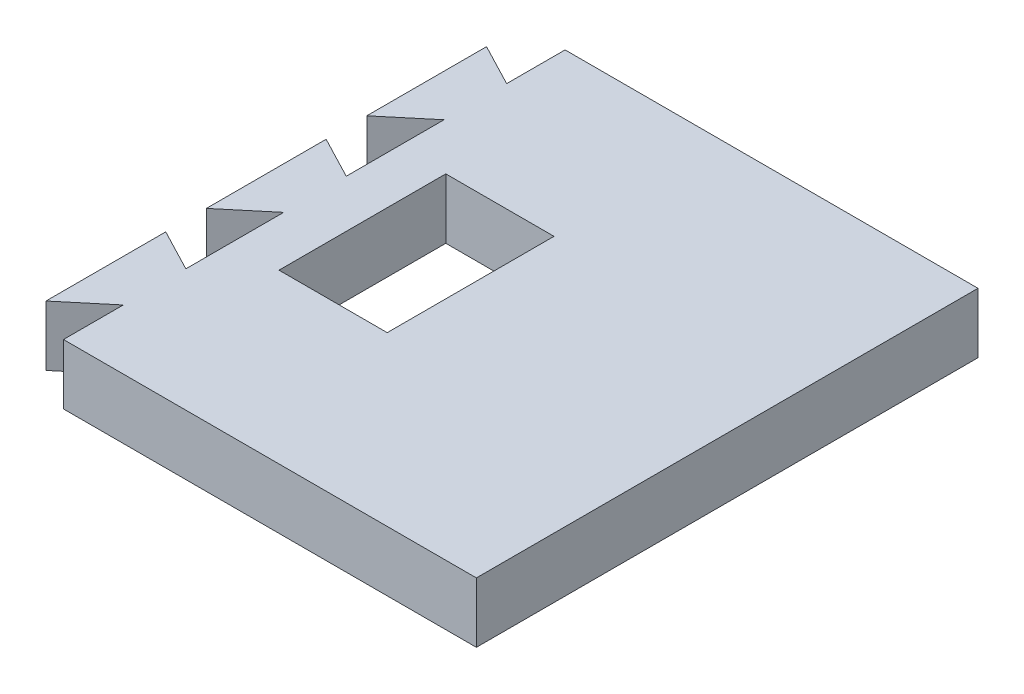
from build123d import *

# Parameters (mm, degrees)
SKETCH1_W           = 280
SKETCH1_H           = 210
BOSS_EXTRUDE1_DEPTH = 15
SKETCH2_R           = 5
BOSS_EXTRUDE2_DEPTH = 50
SKETCH3_W           = 10
SKETCH3_H           = 30
BOSS_EXTRUDE3_DEPTH = 50
SKETCH4_R           = 13
CUT_EXTRUDE1_DEPTH  = 20
SKETCH5_W           = 360.4909063
SKETCH5_H           = 249.182613404
SKETCH5_W_2         = 248.173776912
SKETCH5_H_2         = 125.095724948
CUT_EXTRUDE5_DEPTH  = 15
CUT_EXTRUDE6_START  = -65
SKETCH7_R           = 5
CUT_EXTRUDE6_DEPTH  = 65
SKETCH9_W           = 29.33
SKETCH9_H           = 16.92
CUT_EXTRUDE9_DEPTH  = 148.681383345
SKETCH8_R           = 10.1
CUT_EXTRUDE11_DEPTH = 10
SKETCH11_W          = 17.231524428
SKETCH11_H          = 37.334969593
CUT_EXTRUDE13_DEPTH = 50
SKETCH15_W          = 10
SKETCH15_H          = 50
CUT_EXTRUDE14_DEPTH = 5
SKETCH13_W          = 26.98462743
SKETCH13_H          = 41.59552633
CUT_EXTRUDE17_DEPTH = 140.766916639
CUT_EXTRUDE18_DEPTH = 140.766916639


with BuildPart() as part:
    # Sketch1 → Boss-Extrude1 (new body)
    with BuildSketch(Plane(origin=(0, 0, 0), x_dir=(1, 0, 0), z_dir=(0, 1, 0))):
        Rectangle(SKETCH1_W, SKETCH1_H)
    extrude(amount=BOSS_EXTRUDE1_DEPTH)

    # Sketch2 → Boss-Extrude2 (add)
    with BuildSketch(Plane(origin=(0, 15, 0), x_dir=(1, 0, 0), z_dir=(0, 1, 0))):
        with Locations(Location((-100, 0, 0), (0, 0, 270))):
            Circle(SKETCH2_R)
        with Locations(Location((-100, 45, 0), (0, 0, 270))):
            Circle(SKETCH2_R)
        with Locations(Location((-100, -45, 0), (0, 0, 270))):
            Circle(SKETCH2_R)
    extrude(amount=BOSS_EXTRUDE2_DEPTH)

    # Sketch3 → Boss-Extrude3 (add)
    with BuildSketch(Plane(origin=(0, 15, 0), x_dir=(1, 0, 0), z_dir=(0, 1, 0))):
        Rectangle(SKETCH3_W, SKETCH3_H)
    extrude(amount=BOSS_EXTRUDE3_DEPTH)

    # Sketch4 → Cut-Extrude1 (cut)
    with BuildSketch(Plane(origin=(5, 0, 0), x_dir=(0, 0, -1), z_dir=(1, 0, 0))):
        with Locations((0, 41.236240869)):
            Circle(SKETCH4_R)
    extrude(amount=-CUT_EXTRUDE1_DEPTH, mode=Mode.SUBTRACT)

    # Sketch5 → Cut-Extrude5 (cut)
    with BuildSketch(Plane(origin=(0, 0, 0), x_dir=(1, 0, 0), z_dir=(0, 1, 0))):
        with Locations((1.345115322, -3.19464889)):
            Rectangle(SKETCH5_W, SKETCH5_H)
        Rectangle(SKETCH5_W_2, SKETCH5_H_2, mode=Mode.SUBTRACT)
    extrude(amount=CUT_EXTRUDE5_DEPTH, mode=Mode.SUBTRACT)

    # Sketch7 → Cut-Extrude6 (cut)
    with BuildSketch(Plane(origin=(0, 65, 0), x_dir=(1, 0, 0), z_dir=(0, 1, 0)).offset(CUT_EXTRUDE6_START)):
        with Locations(Location((-100, 45, 0), (0, 0, 270))):
            Circle(SKETCH7_R)
        with Locations(Location((-100, 0, 0), (0, 0, 270))):
            Circle(SKETCH7_R)
        with Locations(Location((-100, -45, 0), (0, 0, 270))):
            Circle(SKETCH7_R)
    extrude(amount=CUT_EXTRUDE6_DEPTH, mode=Mode.SUBTRACT)

    # Sketch9 → Cut-Extrude9 (cut, through all)
    with BuildSketch(Plane(origin=(0, 15, 0), x_dir=(1, 0, 0), z_dir=(0, 1, 0))):
        with Locations((-48.397782089, 47.087862474)):
            Rectangle(SKETCH9_W, SKETCH9_H)
    extrude(amount=-CUT_EXTRUDE9_DEPTH, mode=Mode.SUBTRACT)

    # Sketch8 → Cut-Extrude11 (cut)
    with BuildSketch(Plane.XZ):
        with Locations(Location((-100, 45, 0), (0, 0, 270))):
            Circle(SKETCH8_R)
        with Locations(Location((-100, 0, 0), (0, 0, 270))):
            Circle(SKETCH8_R)
        with Locations(Location((-100, -45, 0), (0, 0, 270))):
            Circle(SKETCH8_R)
    extrude(amount=-CUT_EXTRUDE11_DEPTH, mode=Mode.SUBTRACT)

    # Sketch11 → Cut-Extrude13 (cut)
    with BuildSketch(Plane(origin=(0, 65, 0), x_dir=(1, 0, 0), z_dir=(0, 1, 0))):
        with Locations((-3.002833284, 0.13632265)):
            Rectangle(SKETCH11_W, SKETCH11_H)
    extrude(amount=-CUT_EXTRUDE13_DEPTH, mode=Mode.SUBTRACT)

    # Sketch15 → Cut-Extrude14 (cut)
    with BuildSketch(Plane(origin=(0, 15, 0), x_dir=(1, 0, 0), z_dir=(0, 1, 0))):
        with Locations((-75, 0)):
            Rectangle(SKETCH15_W, SKETCH15_H)
    extrude(amount=-CUT_EXTRUDE14_DEPTH, mode=Mode.SUBTRACT)

    # Sketch13 → Cut-Extrude17 (cut, through all)
    with BuildSketch(Plane(origin=(0, 15, 0), x_dir=(1, 0, 0), z_dir=(0, 1, 0))):
        with Locations((46.507686285, 0.099999998)):
            Rectangle(SKETCH13_W, SKETCH13_H)
        with Locations((-56.507686285, 0.099999998)):
            Rectangle(SKETCH13_W, SKETCH13_H)
    extrude(amount=-CUT_EXTRUDE17_DEPTH, mode=Mode.SUBTRACT)

    # Sketch10 → Cut-Extrude18 (cut, through all)
    with BuildSketch(Plane(origin=(0, 15, 0), x_dir=(1, 0, 0), z_dir=(0, 1, 0))):
        Polygon((10.617962241, 13.45155831), (10.617962241, -16.40773575), (21.11227659, -7.629229077), (21.11227659, -32.023722987), (10.617962241, -26.54844169), (10.617962241, -56.40773575), (21.11227659, -47.629229077), (21.11227659, -62.347862477), (21.11227659, -67.048787633), (-140.704260322, -76.023181518), (-140.704260322, 77.849476584), (21.11227659, 83.143957129), (21.11227659, 62.347862473), (21.11227659, 47.976277013), (10.617962241, 53.45155831), (10.617962241, 23.59226425), (21.11227659, 32.370770923), (21.11227659, 7.976277013), align=None)
    extrude(amount=-CUT_EXTRUDE18_DEPTH, mode=Mode.SUBTRACT)


solid = part.part
